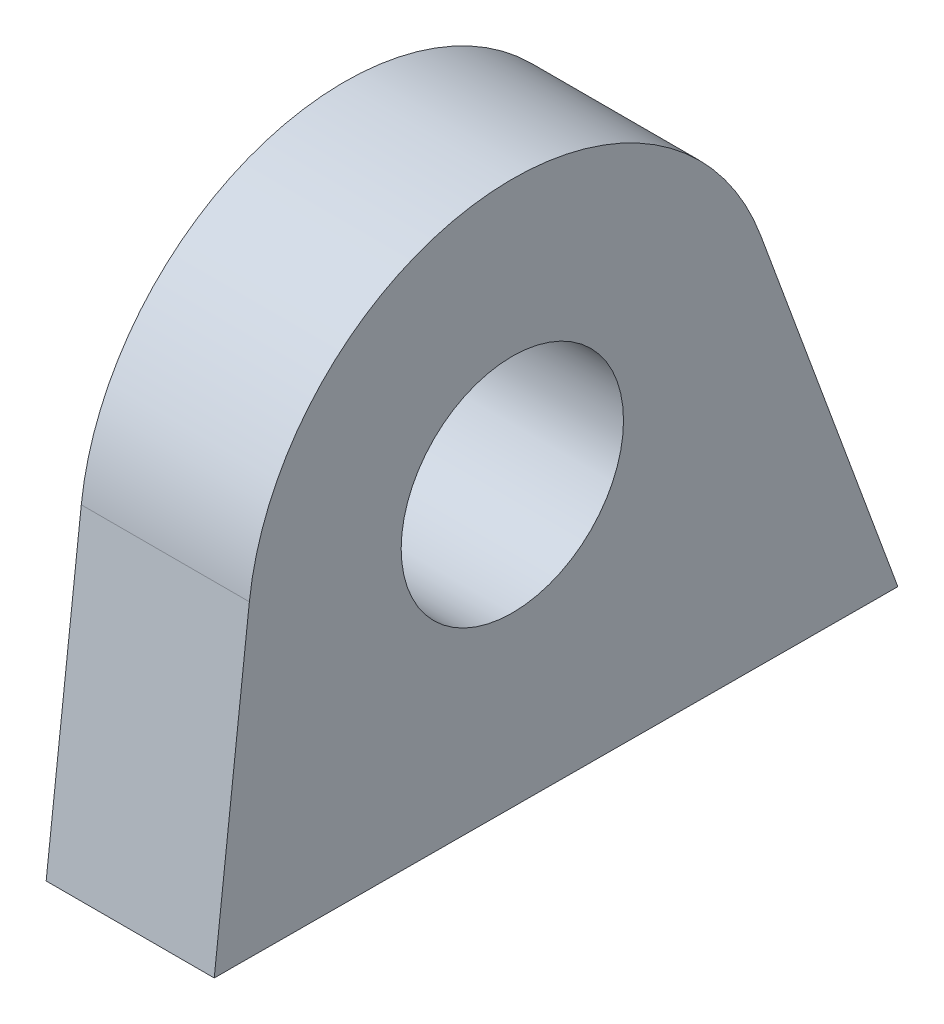
from build123d import *

# Parameters (mm, degrees)
SKETCH1_R           = 4.2
BOSS_EXTRUDE1_DEPTH = 6.35


with BuildPart() as part:
    # Sketch1 → Boss-Extrude1 (new body)
    with BuildSketch(Plane(origin=(71.29240007, 0, 0), x_dir=(0, 0, -1), z_dir=(1, 0, 0))):
        with BuildLine():
            Line((752.39332308, 358.356278755), (751.065744258, 346.710990224))
            Line((751.065744258, 346.710990224), (776.894344503, 346.600522459))
            Line((776.894344503, 346.600522459), (771.713582015, 360.677443288))
            ThreePointArc((771.713582015, 360.677443288), (761.13613116, 367.152203744), (752.39332308, 358.356278755))
        make_face()
        with Locations((762.328968128, 357.223601629)):
            Circle(SKETCH1_R, mode=Mode.SUBTRACT)
    extrude(amount=BOSS_EXTRUDE1_DEPTH)


solid = part.part
